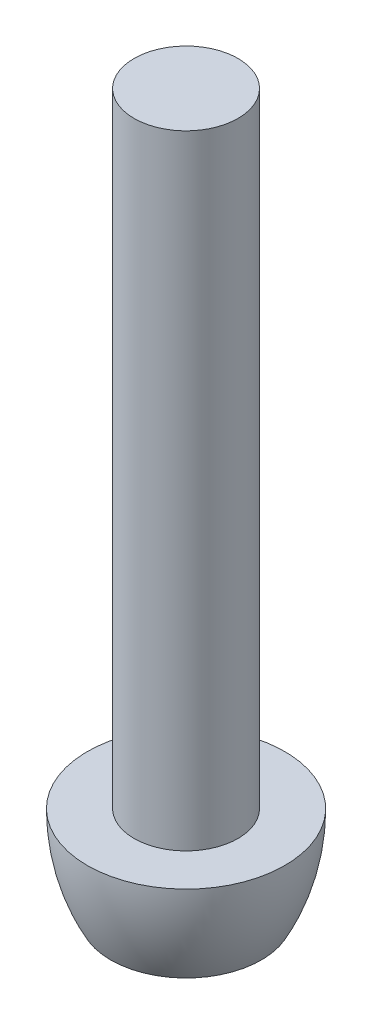
from build123d import *

# Parameters (mm, degrees)
SKETCH_1_R          = 1
EXTRUDE_375_DEPTH   = 12
EXTRUDE_START       = -1.8
SKETCH_1_3_R        = 1.9
SKETCH_1_3_R_2      = 1
EXTRUDE_453_DEPTH   = 1.8
CUT_EXTRUDE_1_DEPTH = 0.6


with BuildPart() as part:
    # 草图1 → Extrude 375 (new body)
    with BuildSketch(Plane(origin=(0, 0, 0), x_dir=(1, 0, 0), z_dir=(0, 1, 0))):
        with Locations(Location((0, 0, 0), (0, 0, 270))):
            Circle(SKETCH_1_R)
    extrude(amount=EXTRUDE_375_DEPTH)

    # 草图1<3> → Extrude 453 (add)
    # profile 1 of 2: a face of its own
    with BuildSketch(Plane(origin=(0, 0, 0), x_dir=(1, 0, 0), z_dir=(0, 1, 0)).offset(EXTRUDE_START)):
        with Locations(Location((0, 0, 0), (0, 0, 270))):
            Circle(SKETCH_1_3_R)
        with Locations(Location((0, 0, 0), (0, 0, 270))):
            Circle(SKETCH_1_3_R_2, mode=Mode.SUBTRACT)
    # profile 2 of 2: a face of its own
    with BuildSketch(Plane(origin=(0, 0, 0), x_dir=(1, 0, 0), z_dir=(0, 1, 0)).offset(EXTRUDE_START)):
        with Locations(Location((0, 0, 0), (0, 0, 270))):
            Circle(SKETCH_1_3_R_2)
    extrude(amount=EXTRUDE_453_DEPTH)

    # 草图2 → 切除-旋转1 (revolve, cut)
    with BuildSketch(Plane.XY, mode=Mode.PRIVATE) as cut_revolve_1_sk:
        with BuildLine():
            Line((-1.9, 0), (-1.9, -1.8))
            Line((-1.9, -1.8), (-1.45, -1.8))
            ThreePointArc((-1.45, -1.8), (-1.785795063, -0.927698766), (-1.9, 0))
        make_face()
    revolve(cut_revolve_1_sk.sketch.rotate(Axis((0, 0, 0), (0, 1, 0)), 90), axis=Axis((0, 0, 0), (0, 1, 0)), mode=Mode.SUBTRACT)

    # 草图3 → 切除-拉伸1 (cut)
    with BuildSketch(Plane.XZ.offset(1.8)):
        Polygon((-0.288675135, -0.5), (0.288675135, -0.5), (0.577350269, 0), (0.288675135, 0.5), (-0.288675135, 0.5), (-0.577350269, 0), align=None)
    extrude(amount=-CUT_EXTRUDE_1_DEPTH, mode=Mode.SUBTRACT)


solid = part.part
